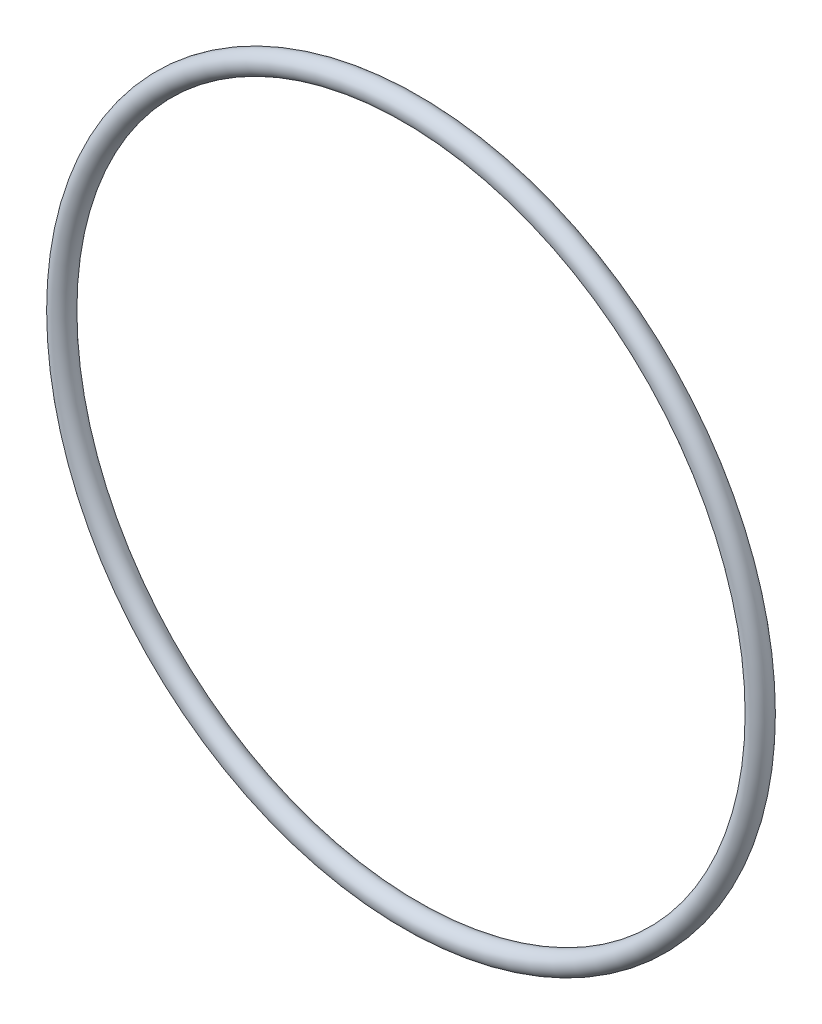
from build123d import *

# Parameters (mm, degrees)
SZKIC2_R = 2.5


with BuildPart() as part:
    # Wyciągnięcie po ścieżce1: sweep along a path in Szkic1
    with BuildLine(Plane.XY) as wyci_gni_cie_po_cie_ce1_path:
        CenterArc((0, 0), 79, 0, 360)
    # Szkic2 → Wyciągnięcie po ścieżce1 (sweep)
    with BuildSketch(Plane(origin=(0, 0, 0), x_dir=(1, 0, 0), z_dir=(0, 1, 0))):
        with Locations((-81.5, 0)):
            Circle(SZKIC2_R)
    sweep(path=wyci_gni_cie_po_cie_ce1_path.line)


solid = part.part
